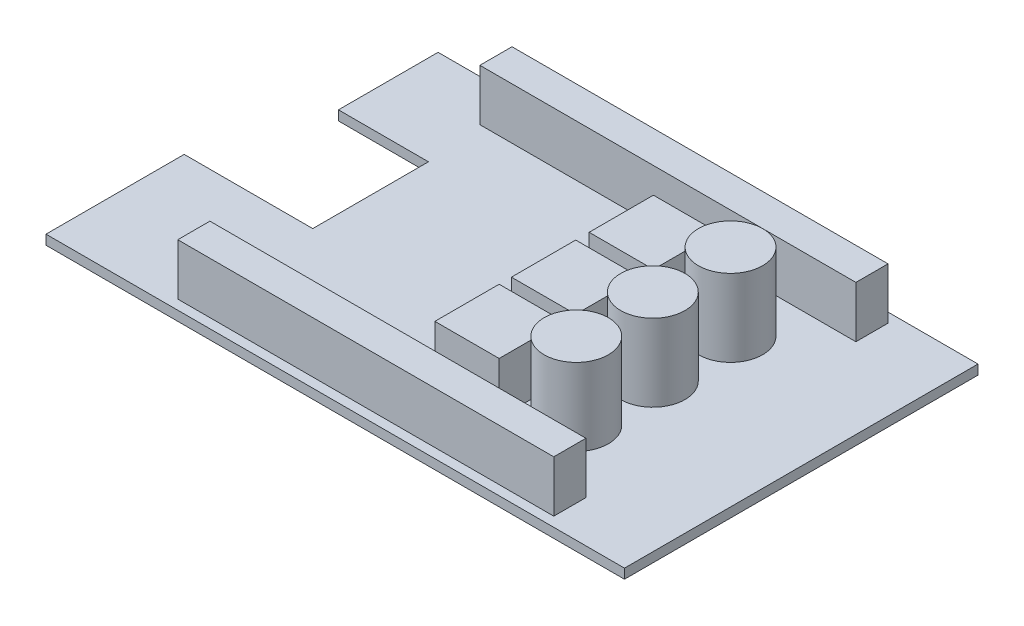
from build123d import *

# Parameters (mm, degrees)
BOSS_EXTRUDE1_DEPTH = 1.5
SKETCH2_W           = 58.5
SKETCH2_H           = 5
BOSS_EXTRUDE2_DEPTH = 8
SKETCH3_W           = 10
SKETCH3_H           = 10
BOSS_EXTRUDE3_DEPTH = 8
SKETCH4_R           = 5
BOSS_EXTRUDE4_DEPTH = 12


with BuildPart() as part:
    # Sketch1 → Boss-Extrude1 (new body)
    with BuildSketch(Plane(origin=(0, 0, 0), x_dir=(1, 0, 0), z_dir=(0, 1, 0))):
        Polygon((0, 0), (0, -21.5), (90, -21.5), (90, 33.5), (6, 33.5), (6, 18), (20, 18), (20, 0), align=None)
    extrude(amount=BOSS_EXTRUDE1_DEPTH)

    # Sketch2 → Boss-Extrude2 (add)
    with BuildSketch(Plane(origin=(0, 1.5, 0), x_dir=(1, 0, 0), z_dir=(0, 1, 0))):
        with Locations((48.25, -17.5)):
            Rectangle(SKETCH2_W, SKETCH2_H)
        with Locations((48.25, 29.5)):
            Rectangle(SKETCH2_W, SKETCH2_H)
    extrude(amount=BOSS_EXTRUDE2_DEPTH)

    # Sketch3 → Boss-Extrude3 (add)
    with BuildSketch(Plane(origin=(0, 1.5, 0), x_dir=(1, 0, 0), z_dir=(0, 1, 0))):
        with Locations((55, 18)):
            Rectangle(SKETCH3_W, SKETCH3_H)
        with Locations((55, 5.912448656)):
            Rectangle(SKETCH3_W, SKETCH3_H)
        with Locations((55, -6)):
            Rectangle(SKETCH3_W, SKETCH3_H)
    extrude(amount=BOSS_EXTRUDE3_DEPTH)

    # Sketch4 → Boss-Extrude4 (add)
    with BuildSketch(Plane(origin=(0, 1.5, 0), x_dir=(1, 0, 0), z_dir=(0, 1, 0))):
        with Locations(Location((67, 18, 0), (0, 0, 270))):
            Circle(SKETCH4_R)
        with Locations(Location((67, 5.912448656, 0), (0, 0, 270))):
            Circle(SKETCH4_R)
        with Locations(Location((67, -6, 0), (0, 0, 270))):
            Circle(SKETCH4_R)
    extrude(amount=BOSS_EXTRUDE4_DEPTH)


solid = part.part
